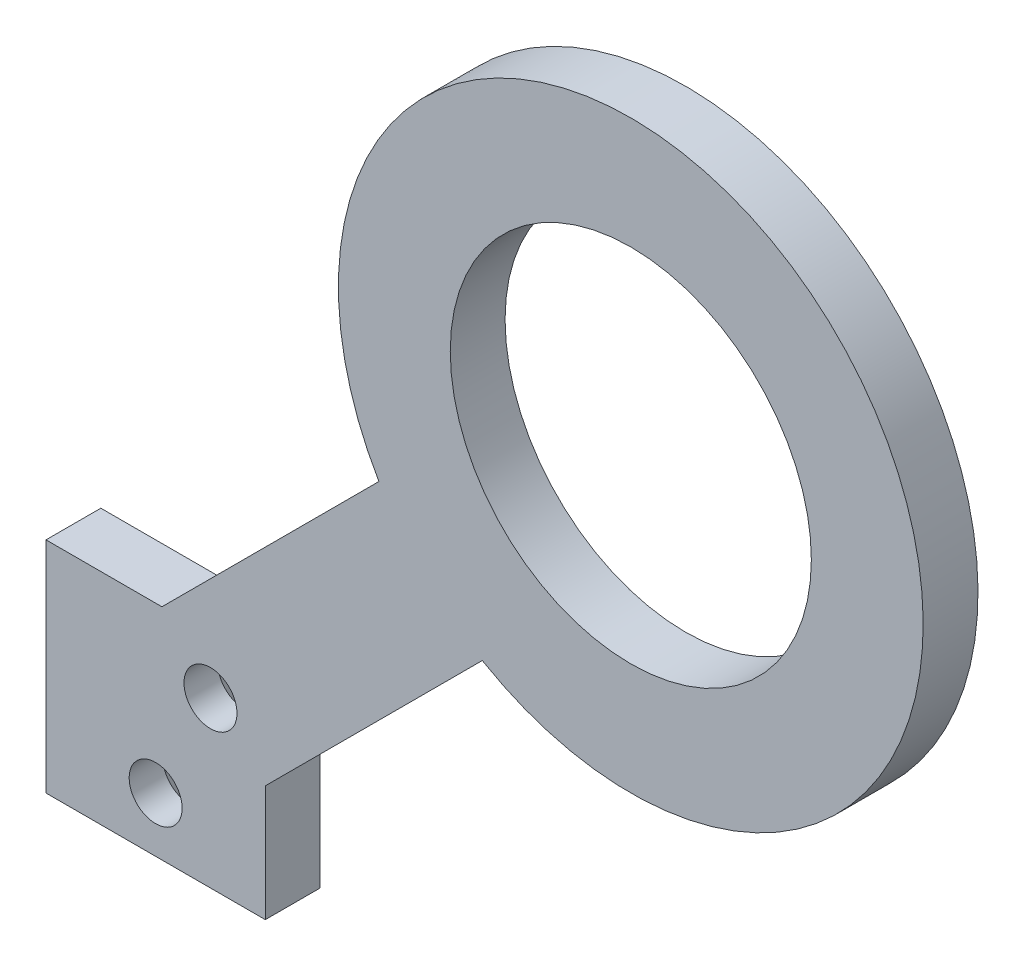
from build123d import *

# Parameters (mm, degrees)
STOP_RING_D19P76_OD32_START               = -3
SKETCH1_R                                 = 16
SKETCH1_R_2                               = 9.88
STOP_RING_D19P76_OD32_DEPTH               = 3
OUTBOARD_BRIDGE_START                     = -3
OUTBOARD_BRIDGE_DEPTH                     = 3
BASE_ATTACHMENT_PAD_START                 = -3
SKETCH3_W                                 = 12
SKETCH3_H                                 = 12
BASE_ATTACHMENT_PAD_DEPTH                 = 3
SKETCH8_R                                 = 1.45
STOP_MOUNT_D2P9_THROUGH_DEPTH             = 3.01
SKETCH9_R                                 = 2.6
STOP_MOUNT_CSK_D5P2_90DEG_DEPTH           = 1.15
STOP_MOUNT_CSK_D5P2_90DEG_DRAFT           = -45
STOP_MOUNT_CSK_D5P2_90DEG_PROFILE_2_DEPTH = 1.15
STOP_MOUNT_CSK_D5P2_90DEG_PROFILE_2_DRAFT = -45


with BuildPart() as part:
    # Sketch1 → Stop_Ring_D19p76_OD32 (new body)
    with BuildSketch(Plane.XY.offset(STOP_RING_D19P76_OD32_START)):
        with Locations((50, 50)):
            Circle(SKETCH1_R)
        with Locations((50, 50)):
            Circle(SKETCH1_R_2, mode=Mode.SUBTRACT)
    extrude(amount=STOP_RING_D19P76_OD32_DEPTH)

    # Sketch2 → Outboard_Bridge (add)
    with BuildSketch(Plane.XY.offset(OUTBOARD_BRIDGE_START)):
        Polygon((21.171572875, 26.828427125), (37.671572875, 43.328427125), (43.328427125, 37.671572875), (26.828427125, 21.171572875), align=None)
    extrude(amount=OUTBOARD_BRIDGE_DEPTH)

    # Sketch3 → Base_Attachment_Pad (add)
    with BuildSketch(Plane.XY.offset(BASE_ATTACHMENT_PAD_START)):
        with Locations((24, 24)):
            Rectangle(SKETCH3_W, SKETCH3_H)
    extrude(amount=BASE_ATTACHMENT_PAD_DEPTH)

    # Sketch8 → Stop_Mount_D2p9_Through (cut)
    with BuildSketch(Plane(origin=(0, 0, -3), x_dir=(-1, 0, 0), z_dir=(0, 0, -1))):
        with Locations((-24, 21)):
            Circle(SKETCH8_R)
        with Locations((-27, 27)):
            Circle(SKETCH8_R)
    extrude(amount=-STOP_MOUNT_D2P9_THROUGH_DEPTH, mode=Mode.SUBTRACT)


with BuildPart() as stop_mount_csk_d5p2_90deg_tool:
    # Sketch9 → Stop_Mount_CSK_D5p2_90deg (with draft: the straight prism first)
    with BuildSketch(Plane(origin=(0, 0, -3), x_dir=(-1, 0, 0), z_dir=(0, 0, -1))):
        with Locations((-24, 21)):
            Circle(SKETCH9_R)
    extrude(amount=-STOP_MOUNT_CSK_D5P2_90DEG_DEPTH)
    # Stop_Mount_CSK_D5p2_90deg: the draft: its side faces are tilted about the plane it starts from
    stop_mount_csk_d5p2_90deg_sides = [stop_mount_csk_d5p2_90deg_tool.faces().sort_by_distance(p)[0] for p in [
        (26.6, 21, -2.425),
    ]]
    draft(stop_mount_csk_d5p2_90deg_sides, Plane(origin=(0, 0, -3), x_dir=(-1, 0, 0), z_dir=(0, 0, -1)), STOP_MOUNT_CSK_D5P2_90DEG_DRAFT)


with BuildPart() as part_1:
    add(part.part)

    # Stop_Mount_CSK_D5p2_90deg: cut by stop_mount_csk_d5p2_90deg_tool
    add(stop_mount_csk_d5p2_90deg_tool.part, mode=Mode.SUBTRACT)


with BuildPart() as stop_mount_csk_d5p2_90deg_profile_2_tool:
    # Sketch9 → Stop_Mount_CSK_D5p2_90deg profile 2 (with draft: the straight prism first)
    with BuildSketch(Plane(origin=(0, 0, -3), x_dir=(-1, 0, 0), z_dir=(0, 0, -1))):
        with Locations((-27, 27)):
            Circle(SKETCH9_R)
    extrude(amount=-STOP_MOUNT_CSK_D5P2_90DEG_PROFILE_2_DEPTH)
    # Stop_Mount_CSK_D5p2_90deg profile 2: the draft: its side faces are tilted about the plane it starts from
    stop_mount_csk_d5p2_90deg_profile_2_sides = [stop_mount_csk_d5p2_90deg_profile_2_tool.faces().sort_by_distance(p)[0] for p in [
        (29.6, 27, -2.425),
    ]]
    draft(stop_mount_csk_d5p2_90deg_profile_2_sides, Plane(origin=(0, 0, -3), x_dir=(-1, 0, 0), z_dir=(0, 0, -1)), STOP_MOUNT_CSK_D5P2_90DEG_PROFILE_2_DRAFT)


with BuildPart() as part_2:
    add(part_1.part)

    # Stop_Mount_CSK_D5p2_90deg profile 2: cut by stop_mount_csk_d5p2_90deg_profile_2_tool
    add(stop_mount_csk_d5p2_90deg_profile_2_tool.part, mode=Mode.SUBTRACT)


solid = part_2.part
